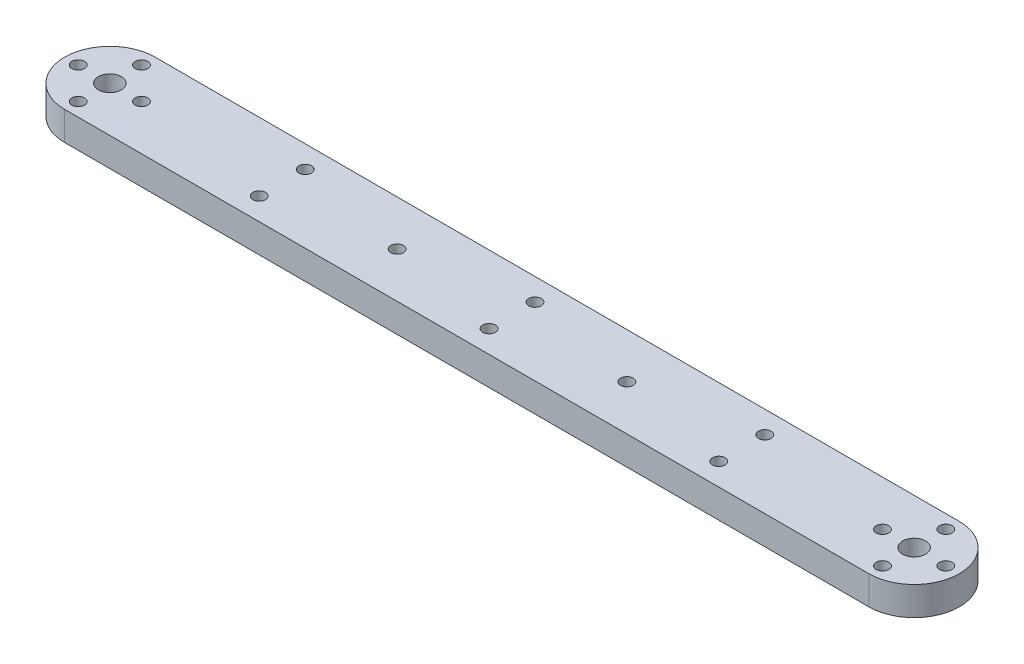
from build123d import *

# Parameters (mm, degrees)
SKETCH1_R           = 1.397
SKETCH1_R_2         = 2.54
BOSS_EXTRUDE1_DEPTH = 6.35


with BuildPart() as part:
    # Sketch1 → Boss-Extrude1 (new body)
    with BuildSketch(Plane(origin=(0, 0, 0), x_dir=(1, 0, 0), z_dir=(0, 1, 0))):
        with BuildLine():
            Line((0, 10), (177.8, 10))
            ThreePointArc((177.8, 10), (187.8, 0), (177.8, -10))
            Line((177.8, -10), (0, -10))
            ThreePointArc((0, -10), (-10, 0), (0, 10))
        make_face()
        with Locations(Location((-7, 0, 0), (0, 0, 270))):
            Circle(SKETCH1_R, mode=Mode.SUBTRACT)
        with Locations(Location((0, 0, 0), (0, 0, 270))):
            Circle(SKETCH1_R_2, mode=Mode.SUBTRACT)
        with Locations(Location((0, 7, 0), (0, 0, 270))):
            Circle(SKETCH1_R, mode=Mode.SUBTRACT)
        with Locations(Location((7, 0, 0), (0, 0, 270))):
            Circle(SKETCH1_R, mode=Mode.SUBTRACT)
        with Locations(Location((0, -7, 0), (0, 0, 270))):
            Circle(SKETCH1_R, mode=Mode.SUBTRACT)
        with Locations(Location((177.8, 7, 0), (0, 0, 90))):
            Circle(SKETCH1_R, mode=Mode.SUBTRACT)
        with Locations(Location((184.8, 0, 0), (0, 0, 90))):
            Circle(SKETCH1_R, mode=Mode.SUBTRACT)
        with Locations(Location((177.8, -7, 0), (0, 0, 90))):
            Circle(SKETCH1_R, mode=Mode.SUBTRACT)
        with Locations(Location((177.8, 0, 0), (0, 0, 90))):
            Circle(SKETCH1_R_2, mode=Mode.SUBTRACT)
        with Locations(Location((170.8, 0, 0), (0, 0, 90))):
            Circle(SKETCH1_R, mode=Mode.SUBTRACT)
        with Locations(Location((88.9, 5.08, 0), (0, 0, 270))):
            Circle(SKETCH1_R, mode=Mode.SUBTRACT)
        with Locations(Location((88.9, -5.08, 0), (0, 0, 90))):
            Circle(SKETCH1_R, mode=Mode.SUBTRACT)
        with Locations(Location((63.5, 0, 0), (0, 0, 270))):
            Circle(SKETCH1_R, mode=Mode.SUBTRACT)
        with Locations(Location((38.1, 5.08, 0), (0, 0, 90))):
            Circle(SKETCH1_R, mode=Mode.SUBTRACT)
        with Locations(Location((38.1, -5.08, 0), (0, 0, 270))):
            Circle(SKETCH1_R, mode=Mode.SUBTRACT)
        with Locations(Location((114.3, 0, 0), (0, 0, 90))):
            Circle(SKETCH1_R, mode=Mode.SUBTRACT)
        with Locations(Location((139.7, 5.08, 0), (0, 0, 270))):
            Circle(SKETCH1_R, mode=Mode.SUBTRACT)
        with Locations(Location((139.7, -5.08, 0), (0, 0, 90))):
            Circle(SKETCH1_R, mode=Mode.SUBTRACT)
    extrude(amount=BOSS_EXTRUDE1_DEPTH)


solid = part.part
